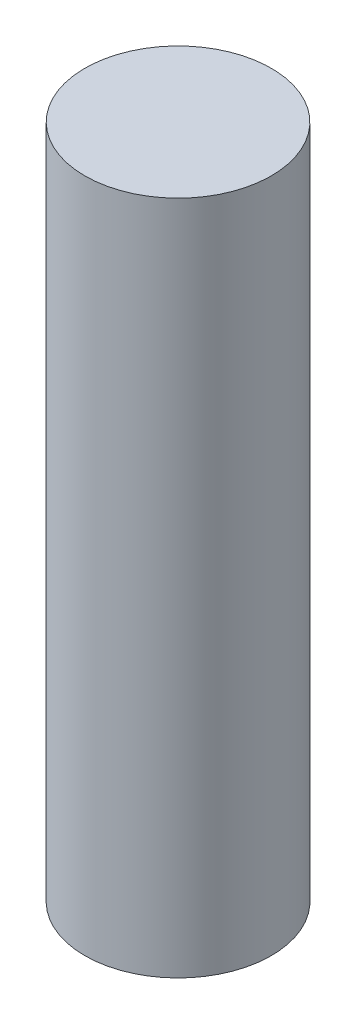
from build123d import *

# Parameters (mm, degrees)
SKETCH1_R           = 9.25
BOSS_EXTRUDE1_DEPTH = 67


with BuildPart() as part:
    # Sketch1 → Boss-Extrude1 (new body)
    with BuildSketch(Plane(origin=(0, 0, 0), x_dir=(1, 0, 0), z_dir=(0, 1, 0))):
        with Locations(Location((0, 0, 0), (0, 0, 270))):
            Circle(SKETCH1_R)
    extrude(amount=BOSS_EXTRUDE1_DEPTH)


solid = part.part
